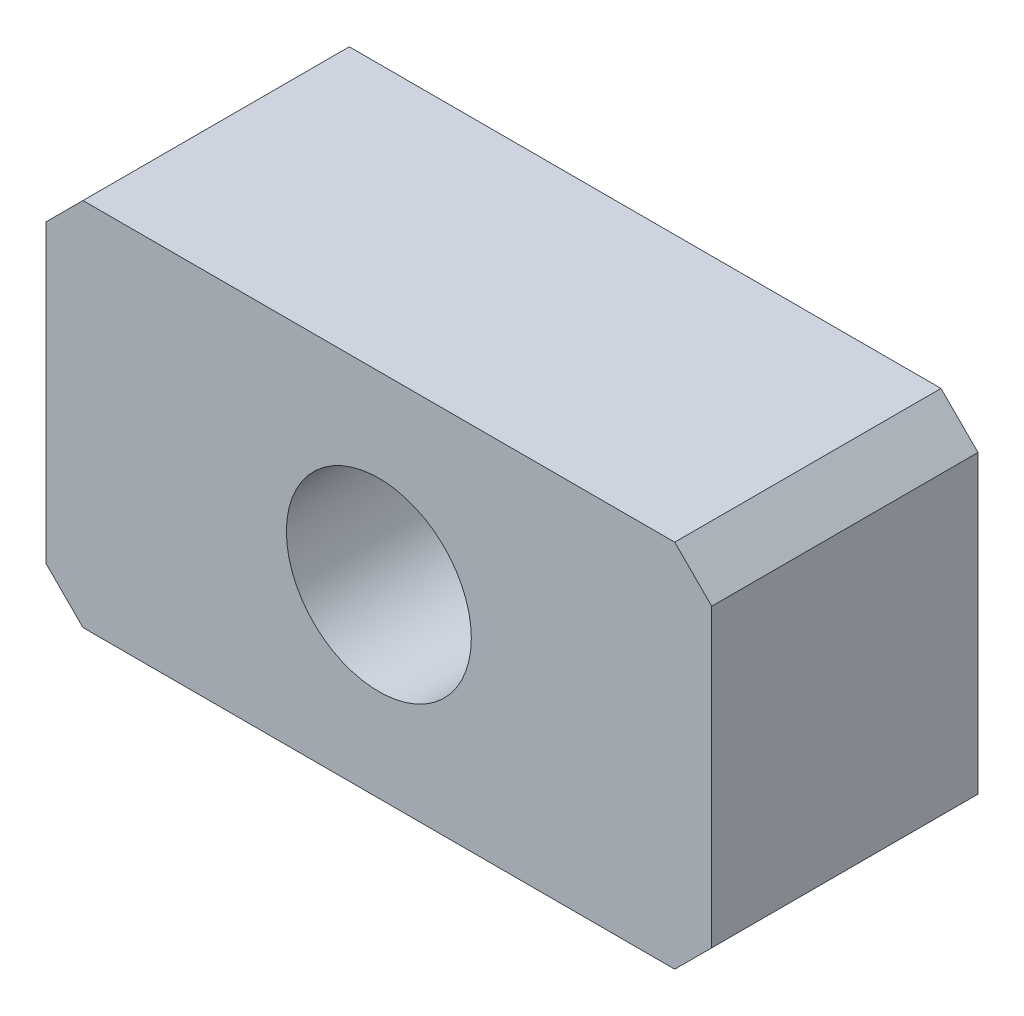
from build123d import *

# Parameters (mm, degrees)
SKETCH1_W           = 18
SKETCH1_H           = 10
SKETCH1_R           = 2.5
BOSS_EXTRUDE1_DEPTH = 7.2
CHAMFER1_SIZE       = 1


with BuildPart() as part:
    # Sketch1 → Boss-Extrude1 (new body)
    with BuildSketch(Plane.XY):
        Rectangle(SKETCH1_W, SKETCH1_H)
        Circle(SKETCH1_R, mode=Mode.SUBTRACT)
    extrude(amount=BOSS_EXTRUDE1_DEPTH)

    # Chamfer1
    chamfer1_edges = [part.edges().sort_by_distance(p)[0] for p in [
        (9, -5, 3.6),
        (-9, -5, 3.6),
        (-9, 5, 3.6),
        (9, 5, 3.6),
    ]]
    chamfer(chamfer1_edges, length=CHAMFER1_SIZE)


solid = part.part
